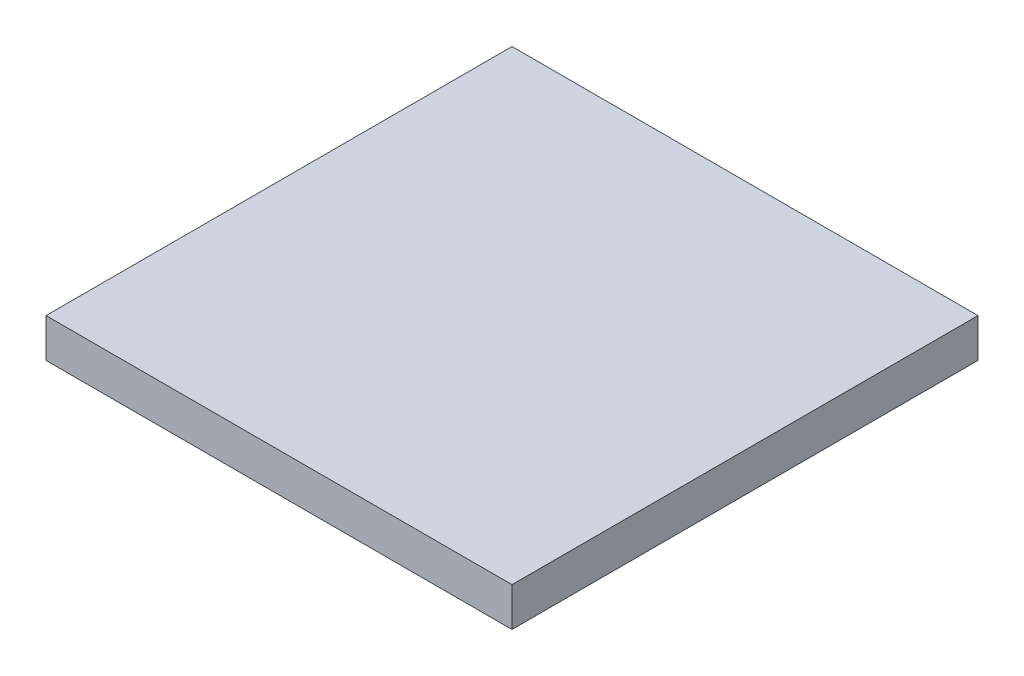
from build123d import *

# Parameters (mm, degrees)
SKETCH_2_W      = 60
SKETCH_2_H      = 60
EXTRUDE_1_DEPTH = 5


with BuildPart() as part:
    # Эскиз2 → Бобышка-Вытянуть1 (new body)
    with BuildSketch(Plane(origin=(0, 0, 0), x_dir=(1, 0, 0), z_dir=(0, 1, 0))):
        Rectangle(SKETCH_2_W, SKETCH_2_H)
    extrude(amount=EXTRUDE_1_DEPTH)


solid = part.part
